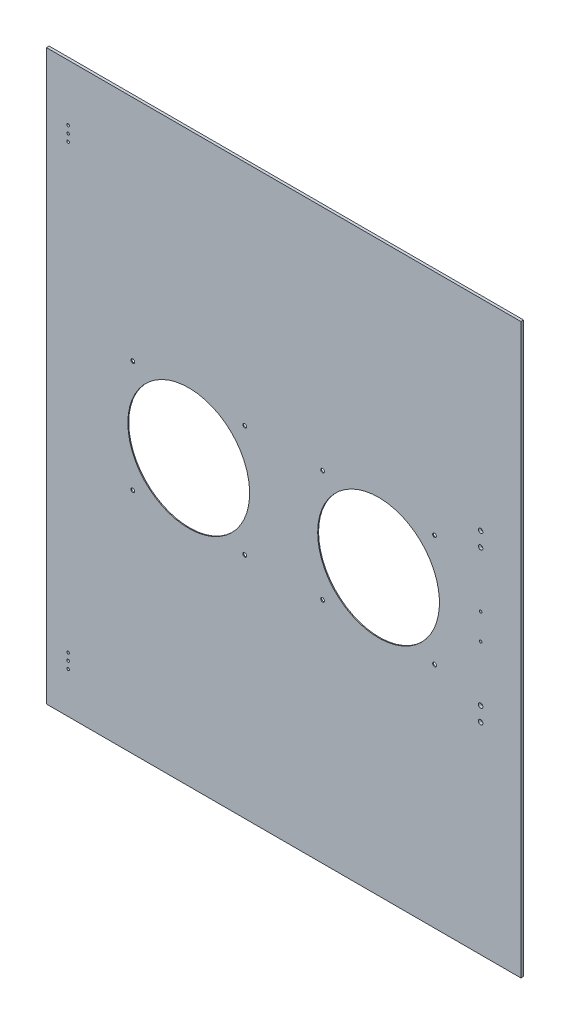
from build123d import *

# Parameters (mm, degrees)
SKETCH1_W           = 530
SKETCH1_H           = 635
BOSS_EXTRUDE1_DEPTH = 3
SKETCH2_R           = 1.5
CUT_EXTRUDE1_DEPTH  = 586.517705704
SKETCH3_R           = 2.5
SKETCH3_R_2         = 1.5
CUT_EXTRUDE2_DEPTH  = 586.517705704
SKETCH13_W          = 141
SKETCH13_H          = 141
CUT_EXTRUDE20_DEPTH = 2
SKETCH14_R          = 2.085
SKETCH14_R_2        = 68
CUT_EXTRUDE21_DEPTH = 586.513435963
SKETCH15_R          = 2.085
SKETCH15_R_2        = 68
CUT_EXTRUDE22_DEPTH = 586.513435963


with BuildPart() as part:
    # Sketch1 → Boss-Extrude1 (new body)
    with BuildSketch(Plane.XY):
        with Locations((-211.504854369, -22.742718447)):
            Rectangle(SKETCH1_W, SKETCH1_H)
    extrude(amount=BOSS_EXTRUDE1_DEPTH)

    # Sketch2 → Cut-Extrude1 (cut, through all)
    with BuildSketch(Plane.XY.offset(3)):
        with Locations((-452.244854369, 231.757281553)):
            Circle(SKETCH2_R)
        with Locations((-452.244854369, 223.757281553)):
            Circle(SKETCH2_R)
        with Locations((-452.244854369, 215.757281553)):
            Circle(SKETCH2_R)
        with Locations((-452.244854369, -278.242718447)):
            Circle(SKETCH2_R)
        with Locations((-452.244854369, -286.242718447)):
            Circle(SKETCH2_R)
        with Locations((-452.244854369, -294.242718447)):
            Circle(SKETCH2_R)
    extrude(amount=-CUT_EXTRUDE1_DEPTH, mode=Mode.SUBTRACT)

    # Sketch3 → Cut-Extrude2 (cut, through all)
    with BuildSketch(Plane.XY.offset(3)):
        with Locations((8.495145631, 69.757281553)):
            Circle(SKETCH3_R)
        with Locations((8.495145631, 53.757281553)):
            Circle(SKETCH3_R)
        with Locations((8.495145631, -99.242718447)):
            Circle(SKETCH3_R)
        with Locations((8.495145631, -115.242718447)):
            Circle(SKETCH3_R)
        with Locations((8.495145631, -8.242718447)):
            Circle(SKETCH3_R_2)
        with Locations((8.495145631, -37.242718447)):
            Circle(SKETCH3_R_2)
    extrude(amount=-CUT_EXTRUDE2_DEPTH, mode=Mode.SUBTRACT)

    # Sketch13 → Cut-Extrude20 (cut)
    with BuildSketch(Plane(origin=(0, 0, 0), x_dir=(-1, 0, 0), z_dir=(0, 0, -1))):
        with Locations((105.504854369, -22.742718447)):
            Rectangle(SKETCH13_W, SKETCH13_H)
        with Locations((317.504854369, -22.742718447)):
            Rectangle(SKETCH13_W, SKETCH13_H)
    extrude(amount=-CUT_EXTRUDE20_DEPTH, mode=Mode.SUBTRACT)

    # Sketch14 → Cut-Extrude21 (cut, through all)
    with BuildSketch(Plane(origin=(0, 0, 2), x_dir=(-1, 0, 0), z_dir=(0, 0, -1))):
        with Locations((43.004854369, 39.757281553)):
            Circle(SKETCH14_R)
        with Locations((168.004854369, 39.757281553)):
            Circle(SKETCH14_R)
        with Locations((43.004854369, -85.242718447)):
            Circle(SKETCH14_R)
        with Locations((168.004854369, -85.242718447)):
            Circle(SKETCH14_R)
        with Locations((105.504854369, -22.742718447)):
            Circle(SKETCH14_R_2)
    extrude(amount=-CUT_EXTRUDE21_DEPTH, mode=Mode.SUBTRACT)

    # Sketch15 → Cut-Extrude22 (cut, through all)
    with BuildSketch(Plane(origin=(0, 0, 2), x_dir=(-1, 0, 0), z_dir=(0, 0, -1))):
        with Locations((255.004854369, 39.757281553)):
            Circle(SKETCH15_R)
        with Locations((380.004854369, 39.757281553)):
            Circle(SKETCH15_R)
        with Locations((255.004854369, -85.242718447)):
            Circle(SKETCH15_R)
        with Locations((380.004854369, -85.242718447)):
            Circle(SKETCH15_R)
        with Locations((317.504854369, -22.80647888)):
            Circle(SKETCH15_R_2)
    extrude(amount=-CUT_EXTRUDE22_DEPTH, mode=Mode.SUBTRACT)


solid = part.part
